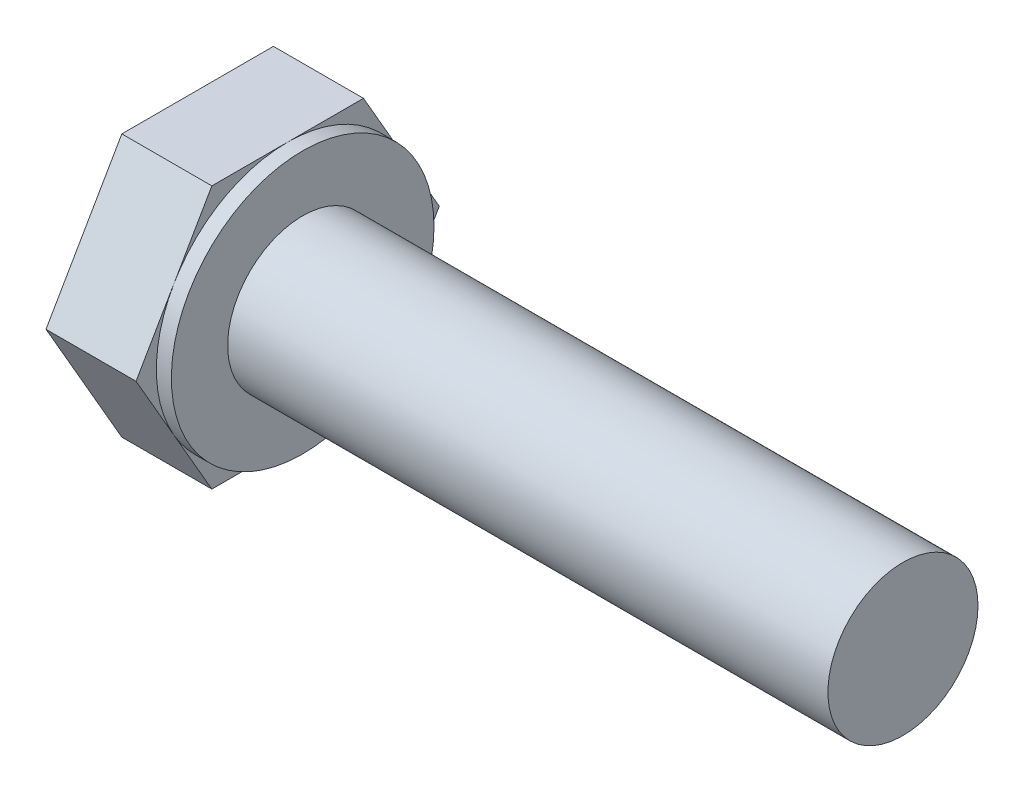
from build123d import *

# Parameters (mm, degrees)
BOSS_EXTRUDE1_DEPTH = 2.4
SKETCH2_R           = 3.5
BOSS_EXTRUDE2_DEPTH = 0.4
SKETCH3_R           = 2
BOSS_EXTRUDE3_DEPTH = 16


with BuildPart() as part:
    # Sketch1 → Boss-Extrude1 (new body)
    with BuildSketch(Plane(origin=(0, 0, 0), x_dir=(0, 0, -1), z_dir=(1, 0, 0))):
        Polygon((-4.041451884, 0), (-2.020725942, -3.5), (2.020725942, -3.5), (4.041451884, 0), (2.020725942, 3.5), (-2.020725942, 3.5), align=None)
    extrude(amount=-BOSS_EXTRUDE1_DEPTH)

    # Sketch2 → Boss-Extrude2 (add)
    with BuildSketch(Plane(origin=(0, 0, 0), x_dir=(0, 0, -1), z_dir=(1, 0, 0))):
        with Locations(Location((0, 0, 0), (0, 0, 150))):
            Circle(SKETCH2_R)
    extrude(amount=BOSS_EXTRUDE2_DEPTH)

    # Sketch3 → Boss-Extrude3 (add)
    with BuildSketch(Plane(origin=(0.4, 0, 0), x_dir=(0, 0, -1), z_dir=(1, 0, 0))):
        Circle(SKETCH3_R)
    extrude(amount=BOSS_EXTRUDE3_DEPTH)


solid = part.part
